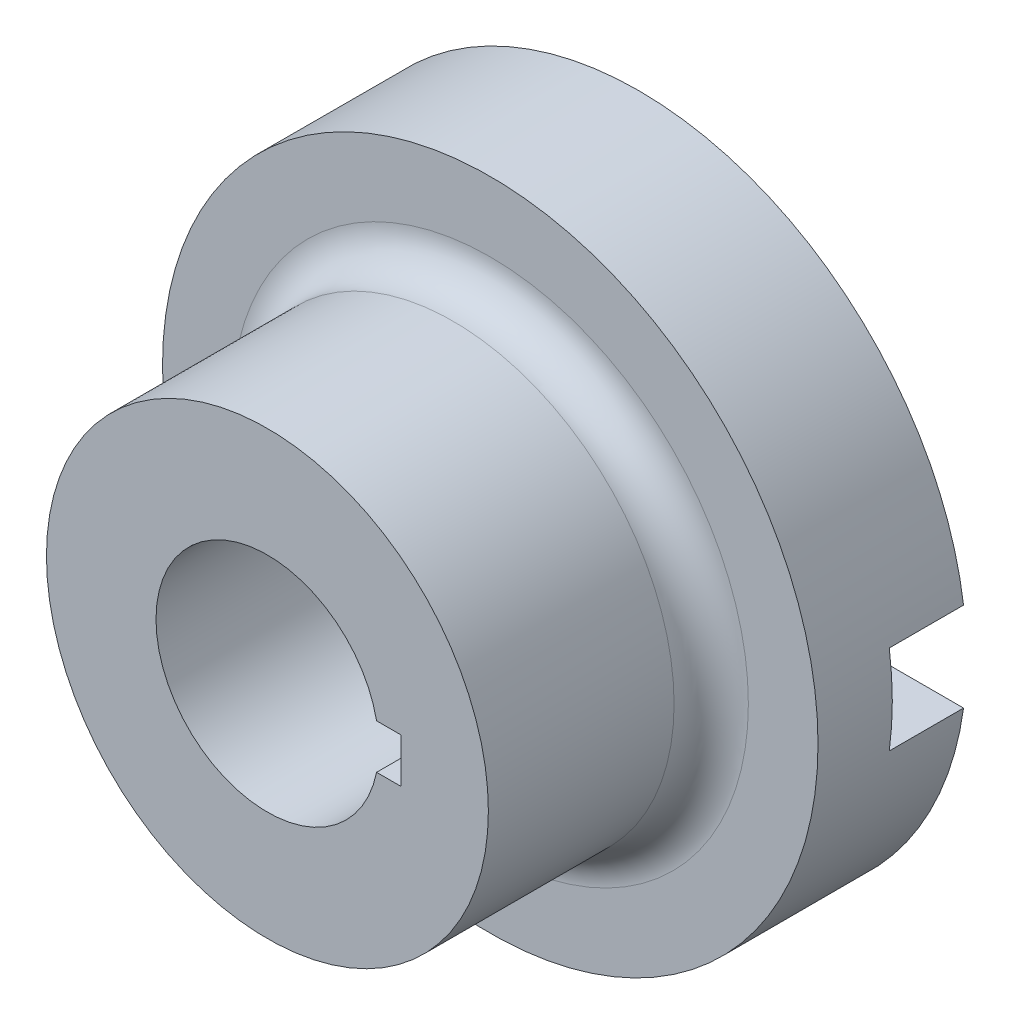
from build123d import *

# Parameters (mm, degrees)
SKETCH2_W          = 118.314728146
SKETCH2_H          = 12
CUT_EXTRUDE1_DEPTH = 10
SKETCH3_W          = 4
SKETCH3_H          = 6
CUT_EXTRUDE2_DEPTH = 80.962050875
FILLET1_R          = 5


with BuildPart() as part:
    # Sketch1 → Revolve1 (revolve)
    with BuildSketch(Plane(origin=(0, 0, 0), x_dir=(0, 0, -1), z_dir=(1, 0, 0)), mode=Mode.PRIVATE) as revolve1_sk:
        Polygon((0, 15), (0, 44.124423963), (-20, 44.124423963), (-20, 29.746543779), (-50, 29.746543779), (-50, 15), align=None)
    revolve(revolve1_sk.sketch.rotate(Axis((0, 0, 0), (0, 0, 1)), 90), axis=Axis((0, 0, 0), (0, 0, 1)))

    # Sketch2 → Cut-Extrude1 (cut)
    with BuildSketch(Plane(origin=(0, 0, 0), x_dir=(-1, 0, 0), z_dir=(0, 0, -1))):
        Rectangle(SKETCH2_W, SKETCH2_H)
    extrude(amount=-CUT_EXTRUDE1_DEPTH, mode=Mode.SUBTRACT)

    # Sketch3 → Cut-Extrude2 (cut, through all)
    with BuildSketch(Plane.XY.offset(50)):
        with Locations((16, 0)):
            Rectangle(SKETCH3_W, SKETCH3_H)
    extrude(amount=-CUT_EXTRUDE2_DEPTH, mode=Mode.SUBTRACT)

    # Fillet1
    fillet1_edges = [part.edges().sort_by_distance(p)[0] for p in [
        (29.746543779, 0, 20),
    ]]
    fillet(fillet1_edges, radius=FILLET1_R)


solid = part.part
